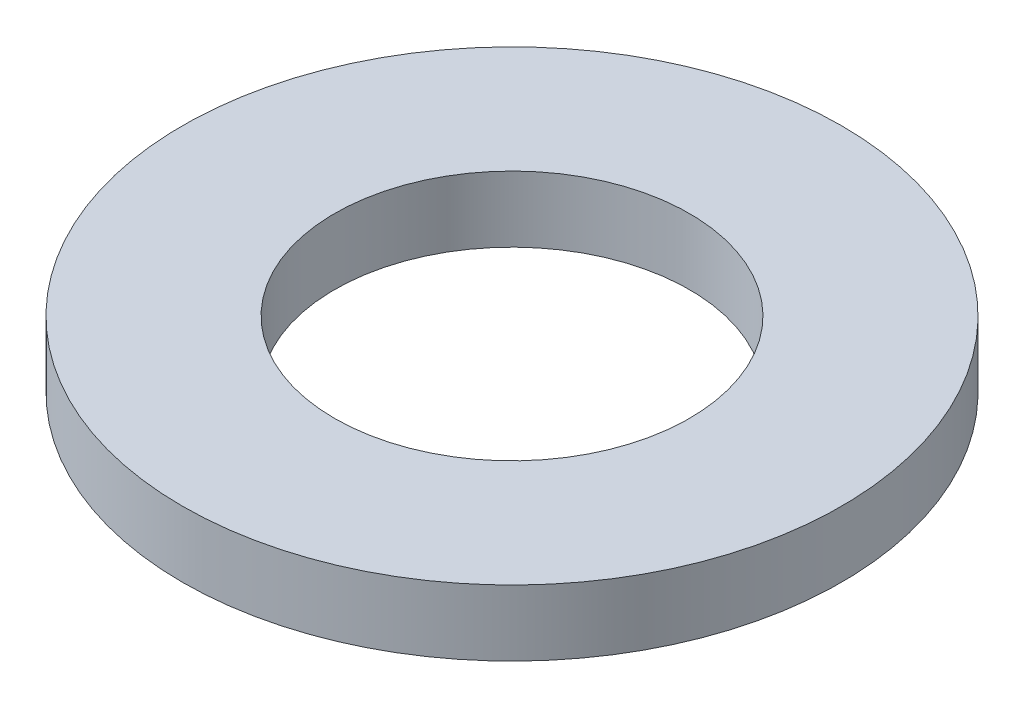
from build123d import *

# Parameters (mm, degrees)
SKETCH_1_R      = 10
SKETCH_1_R_2    = 5.385
EXTRUDE_1_DEPTH = 2


with BuildPart() as part:
    # Эскиз1 → Бобышка-Вытянуть1 (new body)
    with BuildSketch(Plane(origin=(0, 0, 0), x_dir=(1, 0, 0), z_dir=(0, 1, 0))):
        with Locations(Location((0, 0, 0), (0, 0, 270))):
            Circle(SKETCH_1_R)
        with Locations(Location((0, 0, 0), (0, 0, 270))):
            Circle(SKETCH_1_R_2, mode=Mode.SUBTRACT)
    extrude(amount=EXTRUDE_1_DEPTH)


solid = part.part
